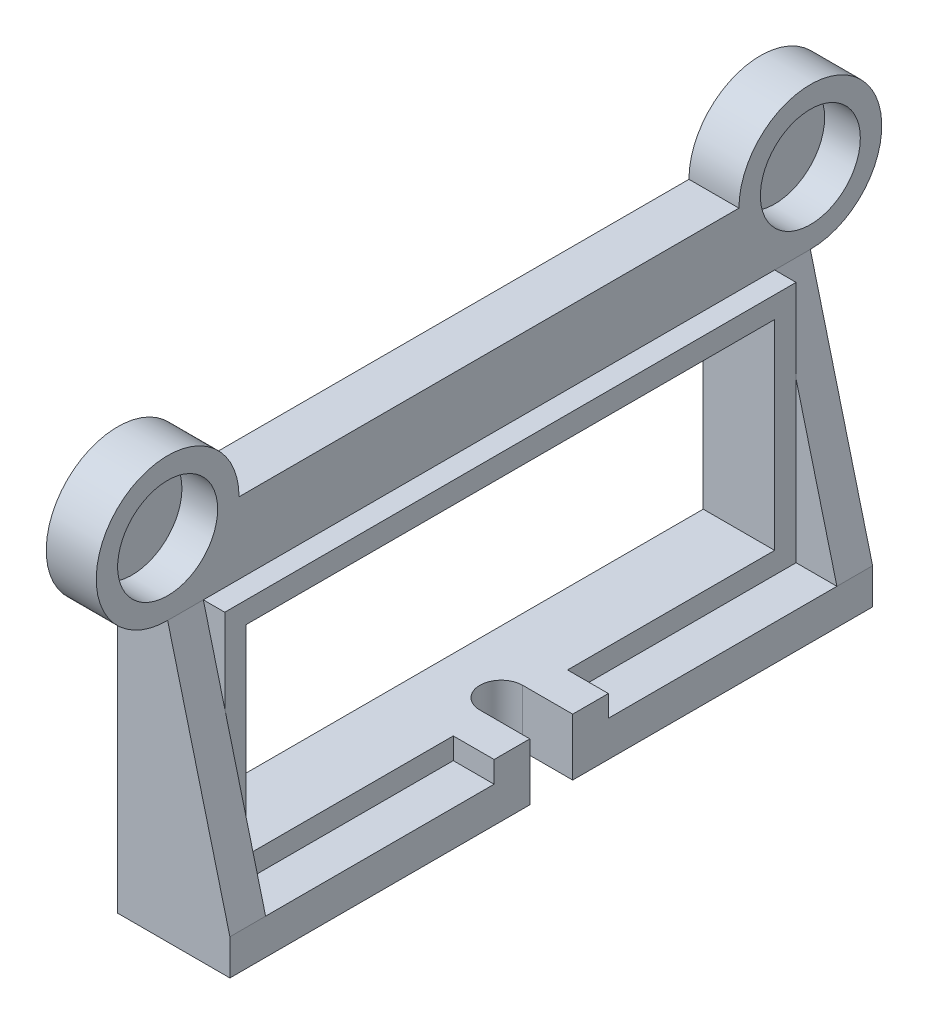
from build123d import *

# Parameters (mm, degrees)
SKETCH1_R             = 10
BOSS_EXTRUDE2_DEPTH   = 7
BOSS_EXTRUDE2_2_DEPTH = 7
BOSS_EXTRUDE3_DEPTH   = 17
CUT_EXTRUDE1_START    = -10
CUT_EXTRUDE1_DEPTH    = 10
CUT_EXTRUDE2_DEPTH    = 113.649900133
SKETCH5_R             = 7
CUT_EXTRUDE3_DEPTH    = 5
SKETCH6_W             = 80
SKETCH6_H             = 34
CUT_EXTRUDE4_DEPTH    = 113.649900133
SKETCH7_W             = 80
SKETCH7_H             = 34
SKETCH7_W_2           = 74
SKETCH7_H_2           = 28
BOSS_EXTRUDE4_DEPTH   = 10
CUT_EXTRUDE5_DEPTH    = 113.649900133
SKETCH9_W             = 90
SKETCH9_H             = 5
BOSS_EXTRUDE5_DEPTH   = 8.75
SKETCH10_W            = 16
SKETCH10_H            = 3
BOSS_EXTRUDE6_DEPTH   = 8.717948718
CUT_EXTRUDE6_DEPTH    = 11


with BuildPart() as part:
    # Sketch1 → Boss-Extrude2 (new body)
    with BuildSketch(Plane(origin=(0, 0, 0), x_dir=(0, 0, -1), z_dir=(1, 0, 0))):
        Circle(SKETCH1_R)
    extrude(amount=BOSS_EXTRUDE2_DEPTH)



with BuildPart() as body_2:
    # Sketch1 → Boss-Extrude2 2 (new body)
    with BuildSketch(Plane(origin=(0, 0, 0), x_dir=(0, 0, -1), z_dir=(1, 0, 0))):
        with Locations((90, 0)):
            Circle(SKETCH1_R)
    extrude(amount=BOSS_EXTRUDE2_2_DEPTH)


with BuildPart() as part_1:
    add(part.part)

    add(body_2.part)  # Boss-Extrude3 merges body 2
    # Sketch1<3> → Boss-Extrude3 (add)
    with BuildSketch(Plane(origin=(0, 0, 0), x_dir=(0, 0, -1), z_dir=(1, 0, 0))):
        with BuildLine():
            Line((80, 0), (10, 0))
            ThreePointArc((10, 0), (7.071067812, -7.071067812), (0, -10))
            Line((0, -10), (0, -49))
            Line((0, -49), (90, -49))
            Line((90, -49), (90, -10))
            ThreePointArc((90, -10), (82.928932188, -7.071067812), (80, 0))
        make_face()
    extrude(amount=BOSS_EXTRUDE3_DEPTH)

    # Sketch3 → Cut-Extrude1 (cut)
    with BuildSketch(Plane(origin=(17, 0, 0), x_dir=(0, 0, -1), z_dir=(1, 0, 0)).offset(CUT_EXTRUDE1_START)):
        with BuildLine():
            Line((0, -10), (90, -10))
            ThreePointArc((90, -10), (82.928932188, -7.071067812), (80, 0))
            Line((80, 0), (10, 0))
            ThreePointArc((10, 0), (7.071067812, -7.071067812), (0, -10))
        make_face()
    extrude(amount=CUT_EXTRUDE1_DEPTH, mode=Mode.SUBTRACT)

    # Sketch4 → Cut-Extrude2 (cut, through all)
    with BuildSketch(Plane.XY):
        Polygon((7, -10), (17, -49), (17, -10), align=None)
    extrude(amount=-CUT_EXTRUDE2_DEPTH, mode=Mode.SUBTRACT)

    # Sketch5 → Cut-Extrude3 (cut)
    with BuildSketch(Plane(origin=(7, 0, 0), x_dir=(0, 0, -1), z_dir=(1, 0, 0))):
        Circle(SKETCH5_R)
        with Locations((90, 0)):
            Circle(SKETCH5_R)
    extrude(amount=-CUT_EXTRUDE3_DEPTH, mode=Mode.SUBTRACT)

    # Sketch6 → Cut-Extrude4 (cut, through all)
    with BuildSketch(Plane.ZY):
        with Locations((-45, -27)):
            Rectangle(SKETCH6_W, SKETCH6_H)
    extrude(amount=-CUT_EXTRUDE4_DEPTH, mode=Mode.SUBTRACT)

    # Sketch7 → Boss-Extrude4 (add)
    with BuildSketch(Plane.ZY):
        with Locations((-45, -27)):
            Rectangle(SKETCH7_W, SKETCH7_H)
        with Locations((-45, -27)):
            Rectangle(SKETCH7_W_2, SKETCH7_H_2, mode=Mode.SUBTRACT)
    extrude(amount=-BOSS_EXTRUDE4_DEPTH)

    # Sketch8 → Cut-Extrude5 (cut, through all)
    with BuildSketch(Plane.XY):
        Polygon((15.717948718, -44), (17, -49), (6.967948718, -49), (6.967948718, -44), align=None)
    extrude(amount=-CUT_EXTRUDE5_DEPTH, mode=Mode.SUBTRACT)

    # Sketch9 → Boss-Extrude5 (add)
    with BuildSketch(Plane(origin=(6.967948718, 0, 0), x_dir=(0, 0, -1), z_dir=(1, 0, 0))):
        with Locations((45, -46.5)):
            Rectangle(SKETCH9_W, SKETCH9_H)
    extrude(amount=BOSS_EXTRUDE5_DEPTH)

    # Sketch10 → Boss-Extrude6 (add)
    with BuildSketch(Plane(origin=(15.717948718, 0, 0), x_dir=(0, 0, -1), z_dir=(1, 0, 0))):
        with Locations((45, -42.5)):
            Rectangle(SKETCH10_W, SKETCH10_H)
    extrude(amount=-BOSS_EXTRUDE6_DEPTH)

    # Sketch11 → Cut-Extrude6 (cut)
    with BuildSketch(Plane(origin=(0, -41, 0), x_dir=(1, 0, 0), z_dir=(0, 1, 0))):
        with BuildLine():
            Line((15.717948718, 42), (8.717948718, 42))
            ThreePointArc((8.717948718, 42), (5.717948718, 45), (8.717948718, 48))
            Line((8.717948718, 48), (15.717948718, 48))
            Line((15.717948718, 48), (15.717948718, 42))
        make_face()
    extrude(amount=-CUT_EXTRUDE6_DEPTH, mode=Mode.SUBTRACT)


solid = part_1.part
